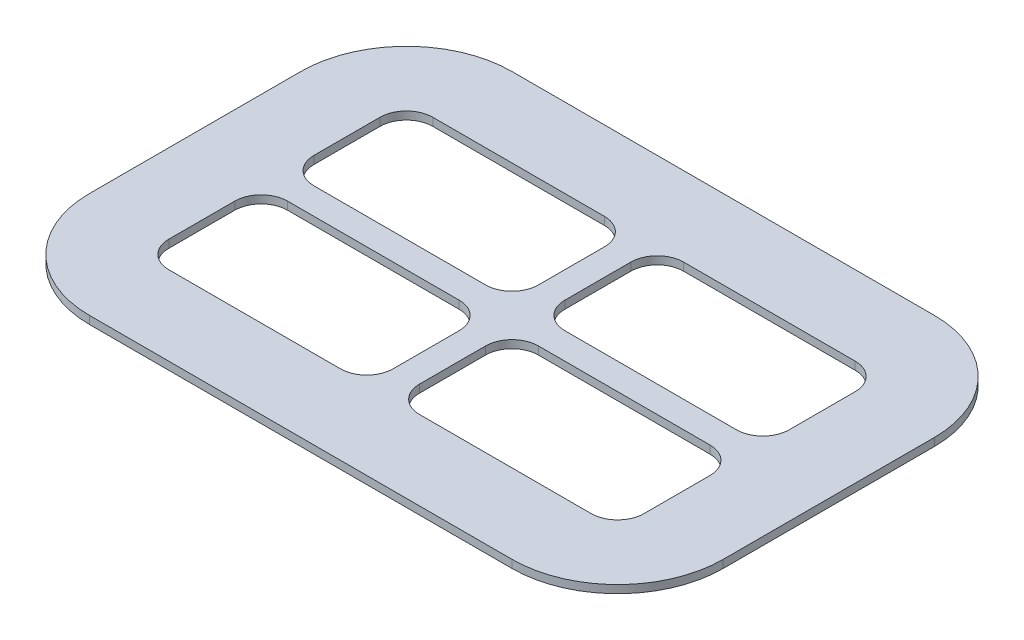
from build123d import *

# Parameters (mm, degrees)
ESBO_O1_W                = 240
ESBO_O1_H                = 160
RESSALTO_EXTRUS_O1_DEPTH = 3
ESBO_O2_W                = 85
ESBO_O2_H                = 45
CORTE_EXTRUS_O1_DEPTH    = 145.25324953
FILETE1_R                = 40
FILETE2_R                = 10


with BuildPart() as part:
    # Esboço1 → Ressalto-extrusão1 (new body)
    with BuildSketch(Plane(origin=(0, 0, 0), x_dir=(1, 0, 0), z_dir=(0, 1, 0))):
        Rectangle(ESBO_O1_W, ESBO_O1_H)
    extrude(amount=RESSALTO_EXTRUS_O1_DEPTH)

    # Esboço2 → Corte-extrusão1 (cut, through all)
    with BuildSketch(Plane(origin=(0, 3, 0), x_dir=(1, 0, 0), z_dir=(0, 1, 0))):
        with Locations((-47.5, -27.5)):
            Rectangle(ESBO_O2_W, ESBO_O2_H)
        with Locations((47.5, 27.5)):
            Rectangle(ESBO_O2_W, ESBO_O2_H)
        with Locations((-47.5, 27.5)):
            Rectangle(ESBO_O2_W, ESBO_O2_H)
        with Locations((47.5, -27.5)):
            Rectangle(ESBO_O2_W, ESBO_O2_H)
    extrude(amount=-CORTE_EXTRUS_O1_DEPTH, mode=Mode.SUBTRACT)

    # Filete1
    filete1_edges = [part.edges().sort_by_distance(p)[0] for p in [
        (-120, 1.5, -80),
        (120, 1.5, -80),
        (120, 1.5, 80),
        (-120, 1.5, 80),
    ]]
    fillet(filete1_edges, radius=FILETE1_R)

    # Filete2
    filete2_edges = [part.edges().sort_by_distance(p)[0] for p in [
        (-90, 1.5, -5),
        (-90, 1.5, -50),
        (-5, 1.5, -50),
        (-5, 1.5, -5),
        (-90, 1.5, 5),
        (-5, 1.5, 5),
        (-5, 1.5, 50),
        (-90, 1.5, 50),
        (90, 1.5, 50),
        (5, 1.5, 50),
        (5, 1.5, 5),
        (90, 1.5, 5),
        (5, 1.5, -50),
        (90, 1.5, -50),
        (90, 1.5, -5),
        (5, 1.5, -5),
    ]]
    fillet(filete2_edges, radius=FILETE2_R)


solid = part.part
